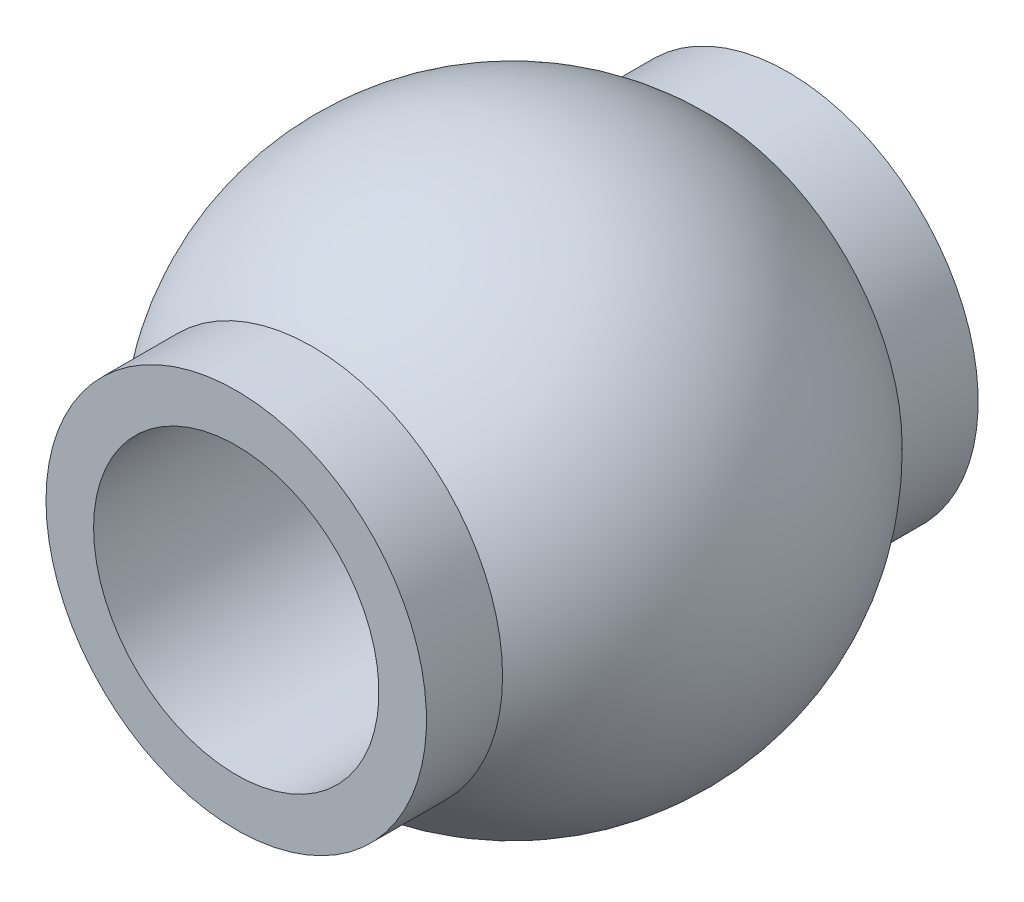
from build123d import *


with BuildPart() as part:
    # Эскиз1 → Повернуть1 (revolve)
    with BuildSketch(Plane(origin=(0, 0, 0), x_dir=(1, 0, 0), z_dir=(0, 1, 0)), mode=Mode.PRIVATE) as revolve_1_sk:
        with BuildLine():
            Line((2, 2.9), (1.5, 2.9))
            Line((1.5, 2.9), (1.5, 2.481934729))
            ThreePointArc((1.5, 2.481934729), (1.760388745, 2.304567522), (2, 2.1))
            Line((2, 2.1), (2, 2.9))
        make_face()
        with BuildLine():
            ThreePointArc((2, 2.1), (1.760388745, 2.304567522), (1.5, 2.481934729))
            Line((1.5, 2.481934729), (1.5, -2.481934729))
            ThreePointArc((1.5, -2.481934729), (1.760388745, -2.304567522), (2, -2.1))
            Line((2, -2.1), (2, 2.1))
        make_face()
        with BuildLine():
            ThreePointArc((2, -2.1), (1.760388745, -2.304567522), (1.5, -2.481934729))
            Line((1.5, -2.481934729), (1.5, -2.9))
            Line((1.5, -2.9), (2, -2.9))
            Line((2, -2.9), (2, -2.1))
        make_face()
        with BuildLine():
            ThreePointArc((2.9, 0), (2.665520587, 1.142365966), (2, 2.1))
            Line((2, 2.1), (2, -2.1))
            ThreePointArc((2, -2.1), (2.665520587, -1.142365966), (2.9, 0))
        make_face()
    revolve(revolve_1_sk.sketch.rotate(Axis((0, 0, -3.556975885), (0, 0, 1)), 180), axis=Axis((0, 0, -3.556975885), (0, 0, 1)))


solid = part.part
